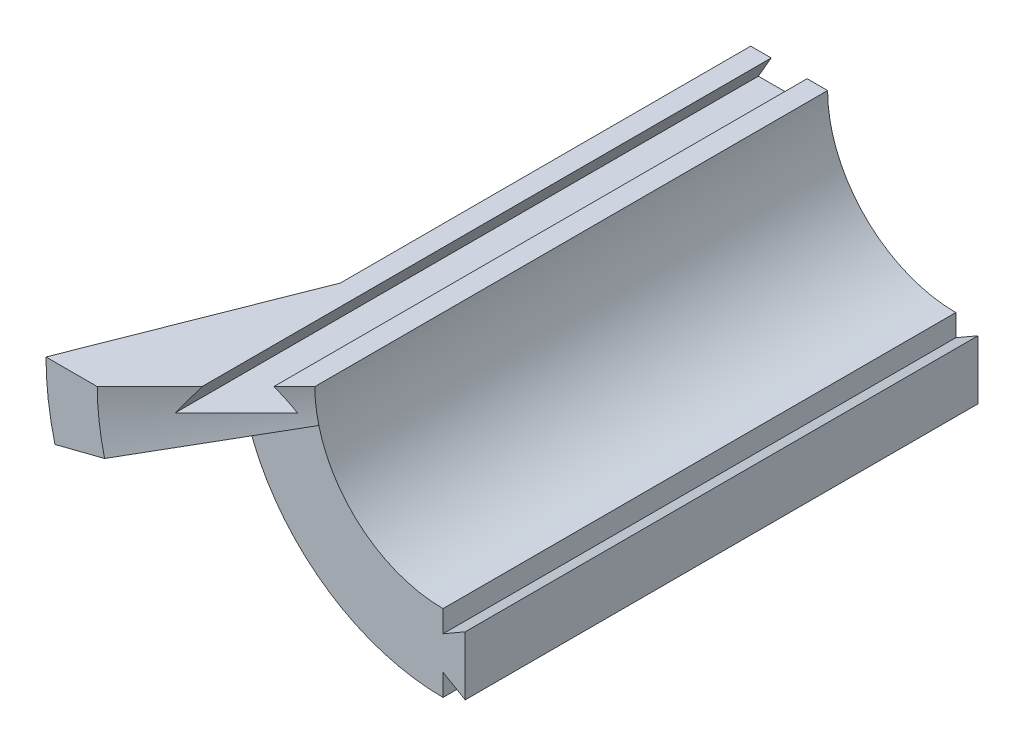
from build123d import *

# Parameters (mm, degrees)
BOSS_EXTRUDE2_DEPTH     = 100
REVOLVE1_ANGLE          = 14.32
CUT_EXTRUDE2_DEPTH      = 140.472452218
CUT_EXTRUDE2_DEPTH_BACK = 140.472452218
BOSS_EXTRUDE4_DEPTH     = 100


with BuildPart() as part:
    # Sketch1 → Boss-Extrude2 (new body)
    with BuildSketch(Plane.XY):
        with BuildLine():
            Line((-40, 0), (-25, 0))
            ThreePointArc((-25, 0), (-17.67766953, -17.67766953), (0, -25))
            Line((0, -25), (0, -40))
            ThreePointArc((0, -40), (-28.284271247, -28.284271247), (-40, 0))
        make_face()
    extrude(amount=BOSS_EXTRUDE2_DEPTH)

    # Sketch2 → Revolve1 (revolve)
    with BuildSketch(Plane(origin=(0, 0, 0), x_dir=(1, 0, 0), z_dir=(0, 1, 0))):
        Polygon((-25, -100), (-46.213203436, -121.213203436), (-56.213203436, -121.213203436), (-40, -80), align=None)
    revolve(axis=Axis((0, 0, 0), (0, 0, 1)), revolution_arc=REVOLVE1_ANGLE)

    # Sketch4 → Cut-Extrude2 (cut, two sides: drawn at the far end of the back side and taken through both)
    with BuildSketch(Plane(origin=(0, 0, 0), x_dir=(-1, 0, 0), z_dir=(0, 0, -1)).offset(-CUT_EXTRUDE2_DEPTH_BACK)):
        Polygon((-98.13708499, 0), (25, 0), (29, 0), (26.5, -4.330127019), (38.5, -4.330127019), (36, 0), (40, 0), (163.13708499, 0), (163.13708499, 246.27416998), (-98.13708499, 246.27416998), align=None)
    extrude(amount=CUT_EXTRUDE2_DEPTH + CUT_EXTRUDE2_DEPTH_BACK, mode=Mode.SUBTRACT)

    # Sketch5 → Boss-Extrude4 (add)
    with BuildSketch(Plane(origin=(0, 0, 0), x_dir=(-1, 0, 0), z_dir=(0, 0, -1))):
        Polygon((0, -35.75), (0, -29.25), (-4.330127019, -26.75), (-4.330127019, -38.25), align=None)
    extrude(amount=-BOSS_EXTRUDE4_DEPTH)


solid = part.part
